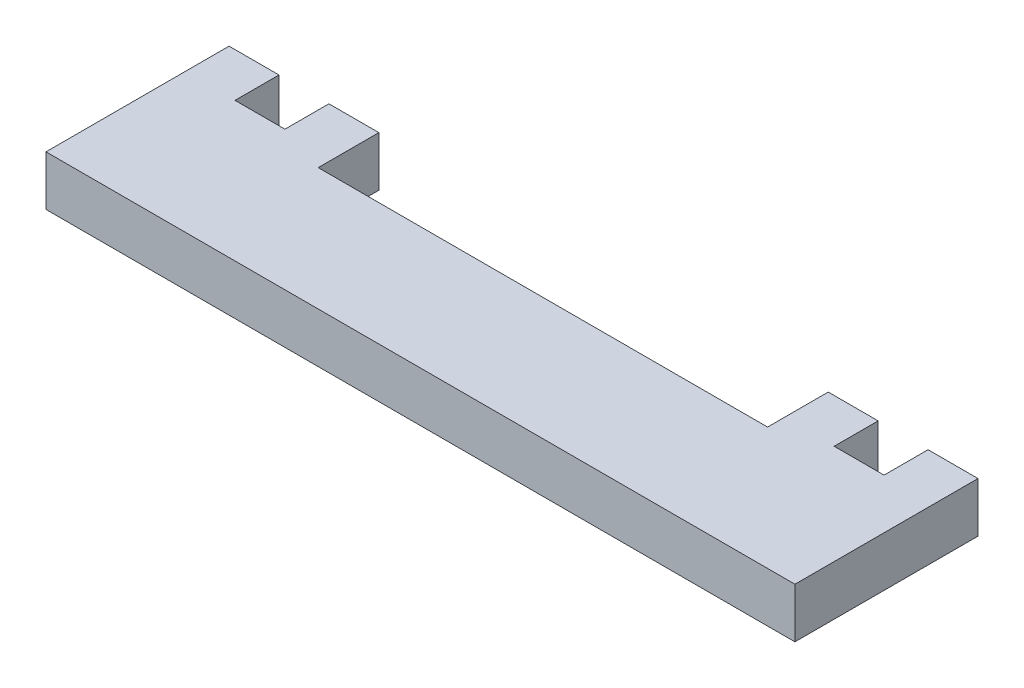
from build123d import *

# Parameters (mm, degrees)
BOSS_EXTRUDE1_DEPTH = 3


with BuildPart() as part:
    # Sketch1 → Boss-Extrude1 (new body)
    with BuildSketch(Plane(origin=(0, 0, 0), x_dir=(1, 0, 0), z_dir=(0, 1, 0))):
        Polygon((13.5, 6.356384138), (13.5, 7), (16.5, 7), (16.5, 4.356384138), (19.5, 4.356384138), (19.5, 7), (22.5, 7), (22.5, 4), (22.5, -4), (-22.5, -4), (-22.5, 4), (-22.5, 7), (-19.5, 7), (-19.5, 4.356384138), (-16.5, 4.356384138), (-16.5, 7), (-13.5, 7), (-13.5, 6.356384138), (-13.5, 3.356384138), (13.5, 3.356384138), align=None)
    extrude(amount=BOSS_EXTRUDE1_DEPTH)


solid = part.part
